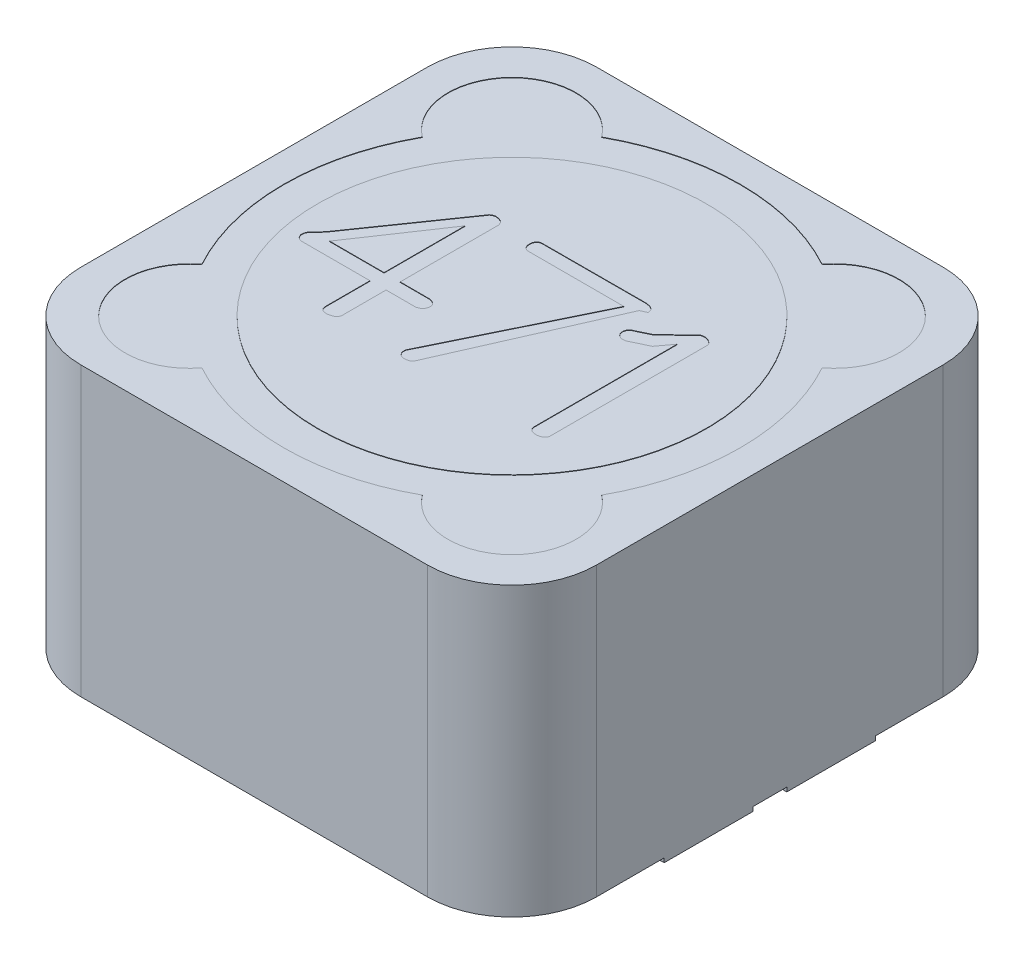
from build123d import *

# Parameters (mm, degrees)
BOSS_EXTRUDE1_DEPTH = 6.8
BOSS_EXTRUDE3_DEPTH = 0.1
CUT_EXTRUDE1_START  = 6.8
SKETCH5_R           = 4.6
CUT_EXTRUDE1_DEPTH  = 0.01
CUT_EXTRUDE2_START  = 6.8
CUT_EXTRUDE2_DEPTH  = 0.01


with BuildPart() as part:
    # Sketch1 → Boss-Extrude1 (new body)
    with BuildSketch(Plane(origin=(0, 0, 0), x_dir=(1, 0, 0), z_dir=(0, 1, 0))):
        with BuildLine():
            Line((-4.1, 6.1), (4.1, 6.1))
            ThreePointArc((4.1, 6.1), (5.514213562, 5.514213562), (6.1, 4.1))
            Line((6.1, 4.1), (6.1, -4.1))
            ThreePointArc((6.1, -4.1), (5.514213562, -5.514213562), (4.1, -6.1))
            Line((4.1, -6.1), (-4.1, -6.1))
            ThreePointArc((-4.1, -6.1), (-5.514213562, -5.514213562), (-6.1, -4.1))
            Line((-6.1, -4.1), (-6.1, 4.1))
            ThreePointArc((-6.1, 4.1), (-5.514213562, 5.514213562), (-4.1, 6.1))
        make_face()
    extrude(amount=BOSS_EXTRUDE1_DEPTH)

    # Sketch4 → Boss-Extrude3 (add)
    with BuildSketch(Plane.XZ):
        with BuildLine():
            Line((-6.1, 0.4), (-5.3, 0.4))
            Line((-5.3, 0.4), (-5.3, -0.4))
            Line((-5.3, -0.4), (-6.1, -0.4))
            Line((-6.1, -0.4), (-6.1, -2.5))
            Line((-6.1, -2.5), (-4.330127019, -2.5))
            ThreePointArc((-4.330127019, -2.5), (-2.860293445, -4.101063448), (-0.85, -4.927220312))
            Line((-0.85, -4.927220312), (-0.85, -0.8))
            Line((-0.85, -0.8), (-1.8, -0.8))
            Line((-1.8, -0.8), (-1.8, 0.8))
            Line((-1.8, 0.8), (-0.85, 0.8))
            Line((-0.85, 0.8), (-0.85, 4.927220312))
            ThreePointArc((-0.85, 4.927220312), (-2.860293445, 4.101063448), (-4.330127019, 2.5))
            Line((-4.330127019, 2.5), (-6.1, 2.5))
            Line((-6.1, 2.5), (-6.1, 0.4))
        make_face()
        with BuildLine():
            Line((0.85, 4.927220312), (0.85, 0.8))
            Line((0.85, 0.8), (1.8, 0.8))
            Line((1.8, 0.8), (1.8, -0.8))
            Line((1.8, -0.8), (0.85, -0.8))
            Line((0.85, -0.8), (0.85, -4.927220312))
            ThreePointArc((0.85, -4.927220312), (2.860293445, -4.101063448), (4.330127019, -2.5))
            Line((4.330127019, -2.5), (6.1, -2.5))
            Line((6.1, -2.5), (6.1, -0.4))
            Line((6.1, -0.4), (5.3, -0.4))
            Line((5.3, -0.4), (5.3, 0.4))
            Line((5.3, 0.4), (6.1, 0.4))
            Line((6.1, 0.4), (6.1, 2.5))
            Line((6.1, 2.5), (4.330127019, 2.5))
            ThreePointArc((4.330127019, 2.5), (2.860293445, 4.101063448), (0.85, 4.927220312))
        make_face()
    extrude(amount=BOSS_EXTRUDE3_DEPTH)

    # Sketch5 → Cut-Extrude1 (cut)
    with BuildSketch(Plane(origin=(0, 0, 0), x_dir=(1, 0, 0), z_dir=(0, 1, 0)).offset(CUT_EXTRUDE1_START)):
        with BuildLine():
            ThreePointArc((2.607445606, 4.72876595), (0, 5.4), (-2.607445606, 4.72876595))
            ThreePointArc((-2.607445606, 4.72876595), (-4.889628841, 4.889628841), (-4.72876595, 2.607445606))
            ThreePointArc((-4.72876595, 2.607445606), (-5.4, 0), (-4.72876595, -2.607445606))
            ThreePointArc((-4.72876595, -2.607445606), (-4.889628841, -4.889628841), (-2.607445606, -4.72876595))
            ThreePointArc((-2.607445606, -4.72876595), (0, -5.4), (2.607445606, -4.72876595))
            ThreePointArc((2.607445606, -4.72876595), (4.889628841, -4.889628841), (4.72876595, -2.607445606))
            ThreePointArc((4.72876595, -2.607445606), (5.4, 0), (4.72876595, 2.607445606))
            ThreePointArc((4.72876595, 2.607445606), (4.889628841, 4.889628841), (2.607445606, 4.72876595))
        make_face()
        with Locations(Location((0, 0, 0), (0, 0, 270))):
            Circle(SKETCH5_R, mode=Mode.SUBTRACT)
    extrude(amount=-CUT_EXTRUDE1_DEPTH, mode=Mode.SUBTRACT)

    # Sketch6 → Cut-Extrude2 (cut)
    # profile 1 of 3: a face of its own
    with BuildSketch(Plane(origin=(0, 0, 0), x_dir=(1, 0, 0), z_dir=(0, 1, 0)).offset(CUT_EXTRUDE2_START)):
        with BuildLine():
            Line((-2.045762299, 1.763954966), (-2.021952776, 1.708151395))
            Line((-2.021952776, 1.708151395), (-2.021952776, -0.622949796))
            Line((-2.021952776, -0.622949796), (-1.324036109, -0.623693843))
            add(Edge.make_bspline(
                [(-1.324036109, -0.623693843), (-1.301334121, -0.628484319), (-1.259858805, -0.637236262), (-1.206636009, -0.666043539), (-1.169534546, -0.708355384), (-1.161936203, -0.743112407), (-1.15811349, -0.760598605)],
                knots=[0, 0, 0, 0, 1.195577152, 2.184255469, 3.086502086, 4, 4, 4, 4], degree=3))
            add(Edge.make_bspline(
                [(-1.15811349, -0.760598605), (-1.158831002, -0.777328461), (-1.160209662, -0.809473959), (-1.174782309, -0.854890673), (-1.199924384, -0.894307894), (-1.223496575, -0.914176354), (-1.235494442, -0.924289081)],
                knots=[0, 0, 0, 0, 1.063672196, 2.043787557, 3.004319249, 4, 4, 4, 4], degree=3))
            Line((-1.235494442, -0.924289081), (-1.31436349, -0.956283129))
            Line((-1.31436349, -0.956283129), (-2.021952776, -0.956283129))
            Line((-2.021952776, -0.956283129), (-2.021952776, -2.014318843))
            add(Edge.make_bspline(
                [(-2.021952776, -2.014318843), (-2.026896484, -2.026491955), (-2.036390558, -2.049869635), (-2.058891334, -2.080148406), (-2.087718431, -2.103864463), (-2.131624699, -2.123033262), (-2.18122779, -2.138710729), (-2.220041169, -2.144389497), (-2.23623849, -2.14675932)],
                knots=[0, 0, 0, 0, 0.881479644, 1.692825178, 2.511522639, 3.362763725, 4.899447501, 6, 6, 6, 6], degree=3))
            add(Edge.make_bspline(
                [(-2.23623849, -2.14675932), (-2.249155575, -2.146355054), (-2.273696633, -2.145586995), (-2.308059101, -2.139303441), (-2.336974777, -2.12764229), (-2.361985758, -2.113293461), (-2.379793889, -2.09198988), (-2.39420096, -2.067650434), (-2.400911881, -2.037956143), (-2.402220483, -2.017064848), (-2.402905156, -2.00613432)],
                knots=[0, 0, 0, 0, 1.244483934, 2.364384402, 3.340480475, 4.242091871, 5.105208837, 5.982430491, 6.944388035, 8, 8, 8, 8], degree=3))
            Line((-2.402905156, -2.00613432), (-2.402905156, -0.956283129))
            Line((-2.402905156, -0.956283129), (-4.030137299, -0.956283129))
            add(Edge.make_bspline(
                [(-4.030137299, -0.956283129), (-4.046129967, -0.952791655), (-4.076949647, -0.946063189), (-4.116762428, -0.919891919), (-4.147241046, -0.882451865), (-4.158268839, -0.85183954), (-4.164065871, -0.835747415)],
                knots=[0, 0, 0, 0, 1.02115313, 1.96787762, 2.931764676, 4, 4, 4, 4], degree=3))
            Line((-4.164065871, -0.835747415), (-4.164809918, -0.796312891))
            add(Edge.make_bspline(
                [(-4.164809918, -0.796312891), (-4.163175419, -0.777280216), (-4.159856745, -0.738636411), (-4.139944722, -0.705328986), (-4.12983968, -0.688425986)],
                knots=[0, 0, 0, 0, 0.985031118, 2, 2, 2, 2], degree=3))
            Line((-4.12983968, -0.688425986), (-3.928946823, -0.473396224))
            Line((-3.928946823, -0.473396224), (-2.34561349, 1.80636568))
            add(Edge.make_bspline(
                [(-2.34561349, 1.80636568), (-2.335675928, 1.813704149), (-2.316874765, 1.827588011), (-2.286563176, 1.84133586), (-2.257959546, 1.8514344), (-2.238796219, 1.852652465), (-2.229542061, 1.85324068)],
                knots=[0, 0, 0, 0, 1.161393316, 2.197273816, 3.129445936, 4, 4, 4, 4], degree=3))
            add(Edge.make_bspline(
                [(-2.229542061, 1.85324068), (-2.222566662, 1.852683214), (-2.207719116, 1.851496613), (-2.193292318, 1.847773953), (-2.185643252, 1.845800204)],
                knots=[0, 0, 0, 0, 0.939603003, 2, 2, 2, 2], degree=3))
            add(Edge.make_bspline(
                [(-2.185643252, 1.845800204), (-2.167590662, 1.841941466), (-2.134941393, 1.834962691), (-2.092803484, 1.817246049), (-2.060965413, 1.794533326), (-2.050577455, 1.773639797), (-2.045762299, 1.763954966)],
                knots=[0, 0, 0, 0, 1.307248616, 2.364243258, 3.241773542, 4, 4, 4, 4], degree=3))
        make_face()
        Polygon((-3.69233968, -0.622949796), (-2.402905156, -0.622949796), (-2.402905156, 1.292228776), align=None, mode=Mode.SUBTRACT)
    # profile 2 of 3: a face of its own
    with BuildSketch(Plane(origin=(0, 0, 0), x_dir=(1, 0, 0), z_dir=(0, 1, 0)).offset(CUT_EXTRUDE2_START)):
        with BuildLine():
            add(Edge.make_bspline(
                [(1.520606748, 1.75949068), (1.525273199, 1.745461488), (1.53344816, 1.720884329), (1.537478295, 1.695315458), (1.539207939, 1.684341871)],
                knots=[0, 0, 0, 0, 1.14164475, 2, 2, 2, 2], degree=3))
            add(Edge.make_bspline(
                [(1.539207939, 1.684341871), (1.513991887, 1.673783369), (1.463901793, 1.652809571), (1.415782086, 1.627642873), (1.39188651, 1.615145442)],
                knots=[0, 0, 0, 0, 1.006827896, 2, 2, 2, 2], degree=3))
            Line((1.39188651, 1.615145442), (-0.229393252, -2.067890272))
            add(Edge.make_bspline(
                [(-0.229393252, -2.067890272), (-0.237303787, -2.080040382), (-0.253527763, -2.104959442), (-0.295188927, -2.129954687), (-0.347960323, -2.144313078), (-0.387262537, -2.145895716), (-0.408708728, -2.14675932)],
                knots=[0, 0, 0, 0, 0.835668763, 1.713900473, 2.752535251, 4, 4, 4, 4], degree=3))
            add(Edge.make_bspline(
                [(-0.408708728, -2.14675932), (-0.424260644, -2.145659215), (-0.453858984, -2.143565501), (-0.495090785, -2.126148433), (-0.528901614, -2.096763956), (-0.544313933, -2.070894699), (-0.552309918, -2.057473605)],
                knots=[0, 0, 0, 0, 1.042786871, 1.984627526, 2.954415127, 4, 4, 4, 4], degree=3))
            add(Edge.make_bspline(
                [(-0.552309918, -2.057473605), (-0.556617957, -2.043929976), (-0.567058653, -2.011106469), (-0.567141946, -1.976569475), (-0.567190871, -1.956283129)],
                knots=[0, 0, 0, 0, 0.825239662, 2, 2, 2, 2], degree=3))
            Line((-0.567190871, -1.956283129), (1.12626151, 1.519907347))
            Line((1.12626151, 1.519907347), (-1.141595633, 1.519907347))
            add(Edge.make_bspline(
                [(-1.141595633, 1.519907347), (-1.156528217, 1.523299182), (-1.184891982, 1.529741819), (-1.221484911, 1.552125661), (-1.248636496, 1.584228273), (-1.257041872, 1.61049473), (-1.261387299, 1.624074014)],
                knots=[0, 0, 0, 0, 1.082423775, 2.056014813, 2.994994755, 4, 4, 4, 4], degree=3))
            add(Edge.make_bspline(
                [(-1.261387299, 1.624074014), (-1.263668804, 1.632214112), (-1.26938294, 1.652601364), (-1.269500938, 1.673824639), (-1.269571823, 1.686574014)],
                knots=[0, 0, 0, 0, 0.798547777, 2, 2, 2, 2], degree=3))
            add(Edge.make_bspline(
                [(-1.269571823, 1.686574014), (-1.268120777, 1.707780741), (-1.265338837, 1.748438211), (-1.241052892, 1.793715165), (-1.214928932, 1.822382557), (-1.189136023, 1.836364694), (-1.159890261, 1.846009188), (-1.138711584, 1.846844483), (-1.127458728, 1.8472883)],
                knots=[0, 0, 0, 0, 1.568043624, 3.006248243, 3.725053685, 4.428734797, 5.165140497, 6, 6, 6, 6], degree=3))
            Line((-1.127458728, 1.8472883), (1.322690082, 1.852496633))
            add(Edge.make_bspline(
                [(1.322690082, 1.852496633), (1.345152181, 1.849401754), (1.386456537, 1.843710747), (1.442638698, 1.826755389), (1.490390447, 1.801085744), (1.510558385, 1.773323025), (1.520606748, 1.75949068)],
                knots=[0, 0, 0, 0, 1.198586307, 2.204016388, 3.105178973, 4, 4, 4, 4], degree=3))
        make_face()
    # profile 3 of 3: a face of its own
    with BuildSketch(Plane(origin=(0, 0, 0), x_dir=(1, 0, 0), z_dir=(0, 1, 0)).offset(CUT_EXTRUDE2_START)):
        with BuildLine():
            Line((2.890547224, 1.767675204), (2.911380558, 1.713359728))
            Line((2.911380558, 1.713359728), (2.91063651, -2.023991462))
            add(Edge.make_bspline(
                [(2.91063651, -2.023991462), (2.90603336, -2.040147931), (2.896680973, -2.072973615), (2.855000415, -2.110034615), (2.798402685, -2.136373832), (2.753760938, -2.143062635), (2.729088891, -2.14675932)],
                knots=[0, 0, 0, 0, 0.841417231, 1.70953787, 2.734135827, 4, 4, 4, 4], degree=3))
            add(Edge.make_bspline(
                [(2.729088891, -2.14675932), (2.706624055, -2.145966716), (2.666042104, -2.144534905), (2.611736091, -2.129746633), (2.56844101, -2.104959459), (2.553319571, -2.078414118), (2.546053177, -2.065658129)],
                knots=[0, 0, 0, 0, 1.270134227, 2.29445362, 3.180423702, 4, 4, 4, 4], degree=3))
            Line((2.546053177, -2.065658129), (2.530428177, -2.031431939))
            Line((2.530428177, -2.031431939), (2.530428177, 1.377794252))
            Line((2.530428177, 1.377794252), (2.281916272, 1.039996633))
            Line((2.281916272, 1.039996633), (1.856321034, 0.838359728))
            add(Edge.make_bspline(
                [(1.856321034, 0.838359728), (1.845436697, 0.836178509), (1.823048898, 0.831691999), (1.800301127, 0.829707037), (1.788612701, 0.828687109)],
                knots=[0, 0, 0, 0, 0.972345423, 2, 2, 2, 2], degree=3))
            add(Edge.make_bspline(
                [(1.788612701, 0.828687109), (1.778395449, 0.829313469), (1.758127879, 0.830555956), (1.728409944, 0.838945247), (1.700756928, 0.853631009), (1.674647335, 0.872455335), (1.653011639, 0.897110354), (1.637339211, 0.925852781), (1.626881412, 0.958191371), (1.626083446, 0.981129613), (1.625666272, 0.993121633)],
                knots=[0, 0, 0, 0, 0.951403609, 1.88726267, 2.847872274, 3.854838563, 4.869456482, 5.872176189, 6.887582364, 8, 8, 8, 8], degree=3))
            add(Edge.make_bspline(
                [(1.625666272, 0.993121633), (1.62638769, 1.002590405), (1.627805382, 1.021197925), (1.632358608, 1.039293729), (1.634594844, 1.048181157)],
                knots=[0, 0, 0, 0, 1.017736074, 2, 2, 2, 2], degree=3))
            add(Edge.make_bspline(
                [(1.634594844, 1.048181157), (1.644967239, 1.066288662), (1.664399406, 1.10021217), (1.697355072, 1.121053625), (1.712719844, 1.130770442)],
                knots=[0, 0, 0, 0, 1.067549056, 2, 2, 2, 2], degree=3))
            Line((1.712719844, 1.130770442), (2.050517463, 1.292228776))
            Line((2.050517463, 1.292228776), (2.59516032, 1.817526395))
            add(Edge.make_bspline(
                [(2.59516032, 1.817526395), (2.601366131, 1.823095434), (2.614134199, 1.834553382), (2.638535984, 1.845142026), (2.66593701, 1.852196824), (2.685385175, 1.85288106), (2.695606748, 1.85324068)],
                knots=[0, 0, 0, 0, 0.909551796, 1.871345807, 2.881221269, 4, 4, 4, 4], degree=3))
            add(Edge.make_bspline(
                [(2.695606748, 1.85324068), (2.713110633, 1.852320145), (2.748160794, 1.850476846), (2.798868784, 1.832748103), (2.847473826, 1.805764143), (2.875851369, 1.780670453), (2.890547224, 1.767675204)],
                knots=[0, 0, 0, 0, 0.959833611, 1.921991747, 2.923863585, 4, 4, 4, 4], degree=3))
        make_face()
    extrude(amount=-CUT_EXTRUDE2_DEPTH, mode=Mode.SUBTRACT)


solid = part.part
